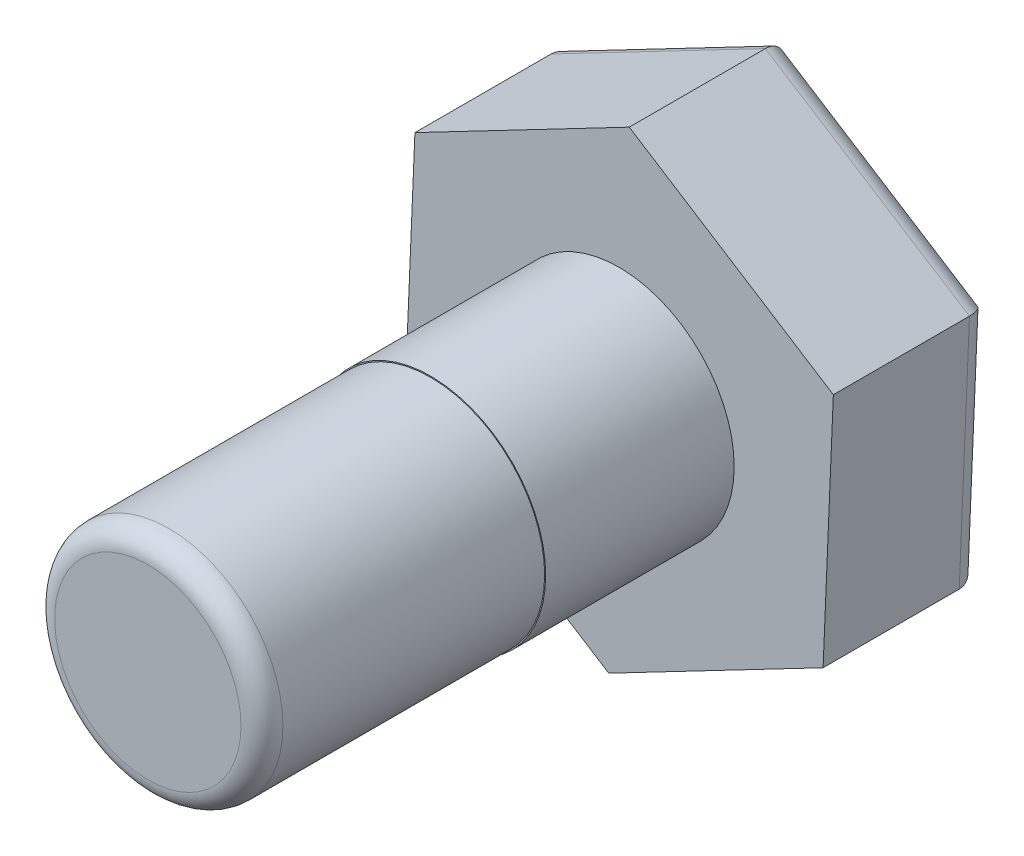
from build123d import *

# Parameters (mm, degrees)
EXTRUDE_430_DEPTH = 15
SKETCH_2_R        = 11
EXTRUDE_1_DEPTH   = 18
FILLET_3_R        = 2
SKETCH_3_R        = 10.9
EXTRUDE_1_2_DEPTH = 27
FILLET_4_R        = 2


with BuildPart() as part:
    # 草图1 → Extrude 430 (new body)
    with BuildSketch(Plane.XY):
        Polygon((20.472392036, 10.687118304), (0.980880074, 23.073170732), (-19.491511963, 12.386052428), (-20.472392036, -10.687118304), (-0.980880074, -23.073170732), (19.491511963, -12.386052428), align=None)
    extrude(amount=EXTRUDE_430_DEPTH)

    # 草图2 → Extrude 1 (add)
    with BuildSketch(Plane.XY.offset(15)):
        Circle(SKETCH_2_R)
    extrude(amount=EXTRUDE_1_DEPTH)

    # 圆角3
    fillet_3_edges = [part.edges().sort_by_distance(p)[0] for p in [
        (9.255315945, -17.72961158, 0),
        (-10.726636055, -16.880144518, 0),
        (-19.981952, 0.849467062, 0),
        (-9.255315945, 17.72961158, 0),
        (10.726636055, 16.880144518, 0),
        (19.981952, -0.849467062, 0),
    ]]
    fillet(fillet_3_edges, radius=FILLET_3_R)

    # 草图3 → Extrude 1 2 (add)
    with BuildSketch(Plane.XY.offset(33)):
        Circle(SKETCH_3_R)
    extrude(amount=EXTRUDE_1_2_DEPTH)

    # 圆角4
    fillet_4_edges = [part.edges().sort_by_distance(p)[0] for p in [
        (-10.9, 0, 60),
    ]]
    fillet(fillet_4_edges, radius=FILLET_4_R)


solid = part.part
